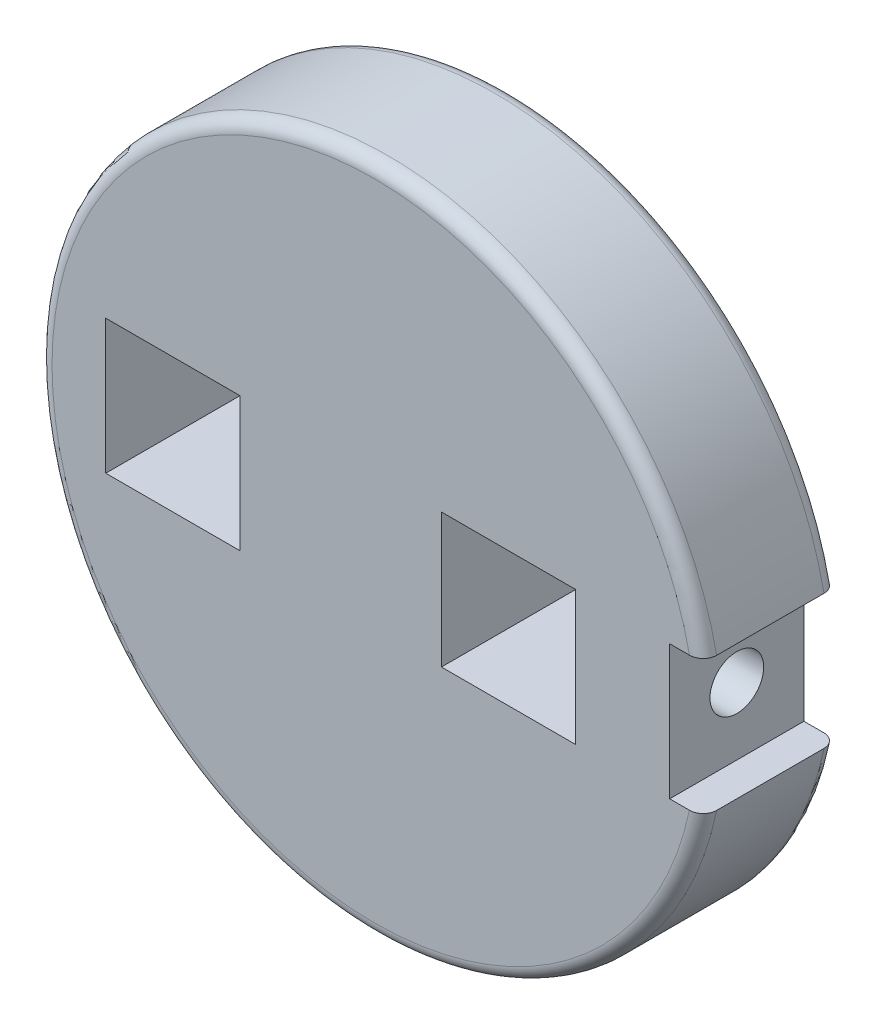
from build123d import *

# Parameters (mm, degrees)
SKETCH1_R               = 25
BOSS_EXTRUDE1_DEPTH     = 10
CUT_EXTRUDE1_DEPTH      = 37.742346142
CUT_EXTRUDE1_DEPTH_BACK = 37.742346142
CUT_EXTRUDE2_DEPTH      = 3
SKETCH5_R               = 2
CUT_EXTRUDE4_DEPTH      = 13
FILLET1_R               = 1
CUT_EXTRUDE6_DEPTH      = 3
CUT_EXTRUDE6_DEPTH_BACK = 3
SKETCH6_W               = 10
SKETCH6_H               = 10
SKETCH7_W               = 10
SKETCH7_H               = 30
BOSS_EXTRUDE2_DEPTH     = 10
SKETCH8_W               = 10
SKETCH8_H               = 10
BOSS_EXTRUDE3_DEPTH     = 10
SKETCH9_W               = 10
SKETCH9_H               = 10
CUT_EXTRUDE7_DEPTH      = 10


with BuildPart() as part:
    # Sketch1 → Boss-Extrude1 (new body)
    with BuildSketch(Plane.XY):
        Circle(SKETCH1_R)
    extrude(amount=BOSS_EXTRUDE1_DEPTH)

    # Sketch2 → Cut-Extrude1 (cut, two sides: drawn at the far end of the back side and taken through both)
    with BuildSketch(Plane.XY.offset(10).offset(-CUT_EXTRUDE1_DEPTH_BACK)):
        Polygon((5, -5), (15, -5), (15, 5), (5, 5), (5, 15), (-5, 15), (-5, 5), (-15, 5), (-15, -5), (-5, -5), (-5, -15), (5, -15), align=None)
    extrude(amount=CUT_EXTRUDE1_DEPTH + CUT_EXTRUDE1_DEPTH_BACK, mode=Mode.SUBTRACT)

    # Sketch4 → Cut-Extrude2 (cut)
    with BuildSketch(Plane.ZY.offset(-15)):
        Polygon((4.759098318, -4.265594884), (8.57366269, -2.341424419), (8.814564373, 1.924170465), (5.240901682, 4.265594884), (1.42633731, 2.341424419), (1.185435627, -1.924170465), align=None)
    extrude(amount=-CUT_EXTRUDE2_DEPTH, mode=Mode.SUBTRACT)

    # Sketch5 → Cut-Extrude4 (cut)
    with BuildSketch(Plane.ZY.offset(-18)):
        with Locations((5, 0)):
            Circle(SKETCH5_R)
    extrude(amount=-CUT_EXTRUDE4_DEPTH, mode=Mode.SUBTRACT)

    # Fillet1
    fillet1_edges = [part.edges().sort_by_distance(p)[0] for p in [
        (-25, 0, 0),
        (-25, 0, 10),
    ]]
    fillet(fillet1_edges, radius=FILLET1_R)

    # Sketch6 → Cut-Extrude6 (cut, two sides: drawn at the far end of the back side and taken through both)
    with BuildSketch(Plane.YZ.offset(24.999151456).offset(-CUT_EXTRUDE6_DEPTH_BACK)):
        with Locations((0, 5)):
            Rectangle(SKETCH6_W, SKETCH6_H)
    extrude(amount=CUT_EXTRUDE6_DEPTH + CUT_EXTRUDE6_DEPTH_BACK, mode=Mode.SUBTRACT)

    # Sketch7 → Boss-Extrude2 (add)
    with BuildSketch(Plane(origin=(0, 0, 0), x_dir=(-1, 0, 0), z_dir=(0, 0, -1))):
        Rectangle(SKETCH7_W, SKETCH7_H)
    extrude(amount=-BOSS_EXTRUDE2_DEPTH)

    # Sketch8 → Boss-Extrude3 (add)
    with BuildSketch(Plane(origin=(0, 0, 0), x_dir=(-1, 0, 0), z_dir=(0, 0, -1))):
        with Locations((10, 0)):
            Rectangle(SKETCH8_W, SKETCH8_H)
    extrude(amount=-BOSS_EXTRUDE3_DEPTH)

    # Sketch9 → Cut-Extrude7 (cut)
    with BuildSketch(Plane(origin=(0, 0, 0), x_dir=(-1, 0, 0), z_dir=(0, 0, -1))):
        with Locations((15, 0)):
            Rectangle(SKETCH9_W, SKETCH9_H)
    extrude(amount=-CUT_EXTRUDE7_DEPTH, mode=Mode.SUBTRACT)


solid = part.part
